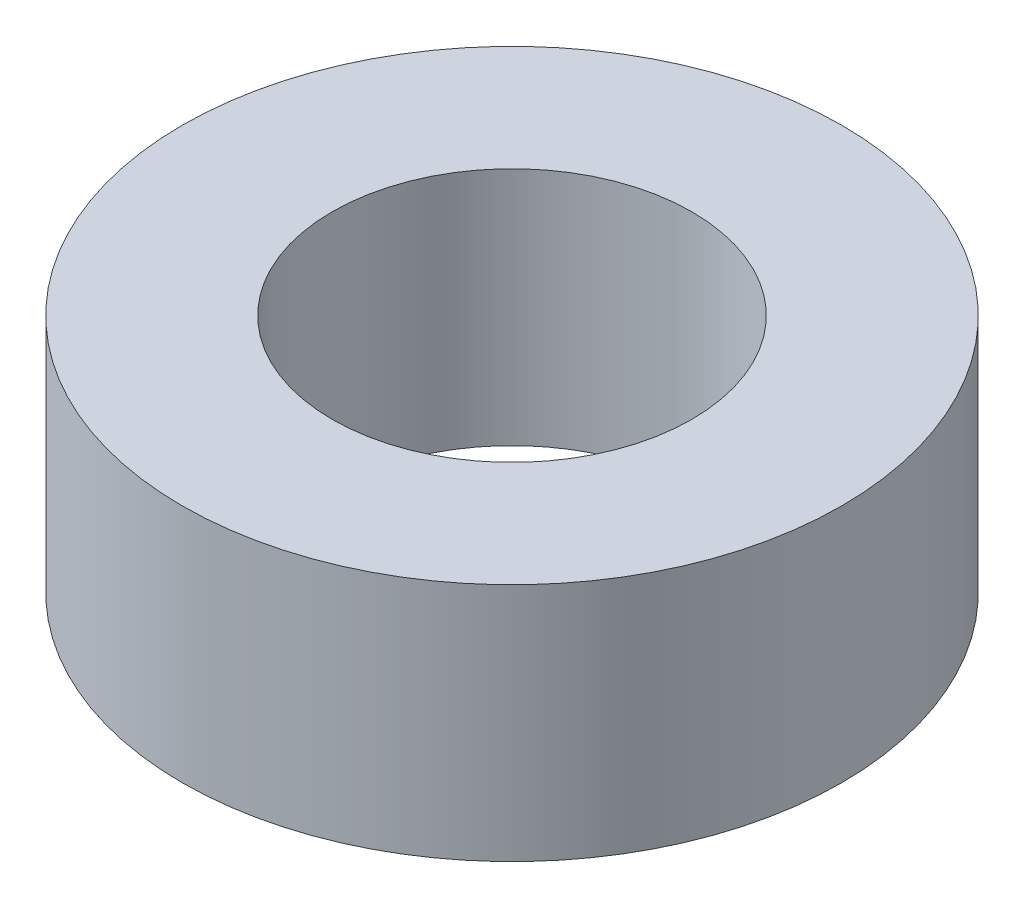
from build123d import *

# Parameters (mm, degrees)
SKETCH2_R           = 5.5
SKETCH2_R_2         = 3
BOSS_EXTRUDE1_DEPTH = 4


with BuildPart() as part:
    # Sketch2 → Boss-Extrude1 (new body)
    with BuildSketch(Plane(origin=(0, 0, 0), x_dir=(1, 0, 0), z_dir=(0, 1, 0))):
        with Locations(Location((0, 0, 0), (0, 0, 270))):
            Circle(SKETCH2_R)
        with Locations(Location((0, 0, 0), (0, 0, 270))):
            Circle(SKETCH2_R_2, mode=Mode.SUBTRACT)
    extrude(amount=BOSS_EXTRUDE1_DEPTH)


solid = part.part
